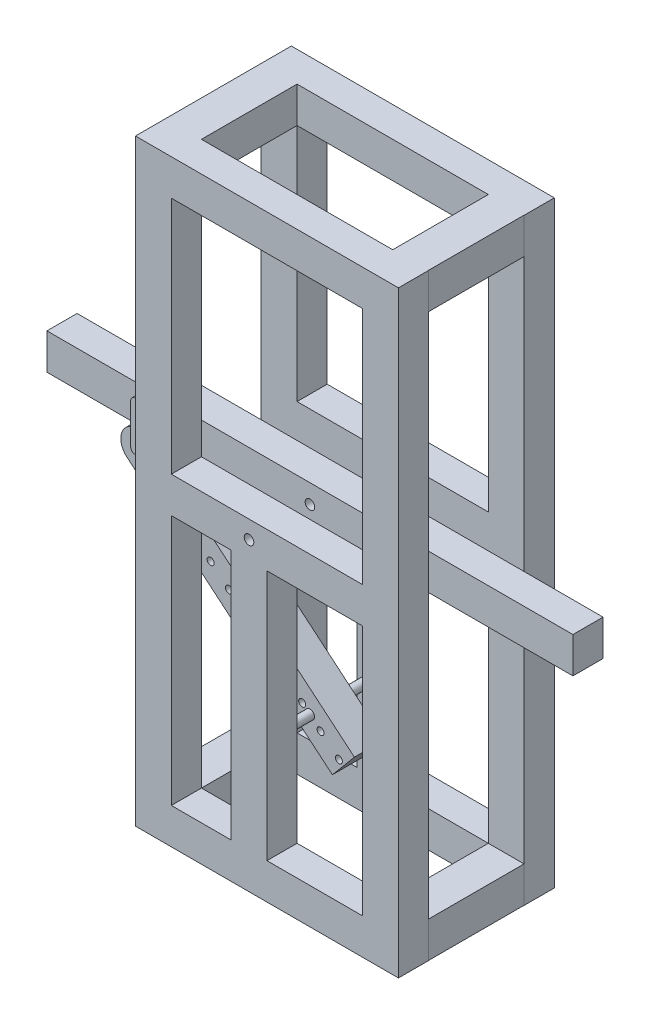
from build123d import *

# Parameters (mm, degrees)
ESQUISSE1_W                = 550
ESQUISSE1_H                = 1250
ESQUISSE1_W_2              = 125
ESQUISSE1_H_2              = 525
ESQUISSE1_W_3              = 200
ESQUISSE1_W_4              = 400
ESQUISSE1_H_3              = 500
BOSS_EXTRU_1_DEPTH         = 63
R_P_TITION_LIN_AIRE1_COUNT = 2
R_P_TITION_LIN_AIRE1_PITCH = 263
ESQUISSE2_W                = 75
ESQUISSE2_H                = 75
ESQUISSE2_W_2              = 74.718169062
BOSS_EXTRU_2_DEPTH         = 200
BOSS_EXTRU_4_DEPTH         = 550
BOSS_EXTRU_4_DEPTH_BACK    = 550
ESQUISSE7_W                = 63
ESQUISSE7_H                = 75
ESQUISSE3_R                = 10
ENL_V_MAT_EXTRU_2_DEPTH    = 1513.921759378
BOSS_EXTRU_5_DEPTH         = 63
BOSS_EXTRU_6_DEPTH         = 5
ESQUISSE12_R               = 7.355365699
ENL_V_MAT_EXTRU_3_DEPTH    = 100
R_P_TITION_LIN_AIRE2_COUNT = 12
R_P_TITION_LIN_AIRE2_PITCH = 50
BOSS_EXTRU_7_START         = -263
ESQUISSE13_R               = 9.503964929
BOSS_EXTRU_7_DEPTH         = 200


with BuildPart() as part:
    # Esquisse1 → Boss.-Extru.1 (new body)
    with BuildSketch(Plane.XY):
        with Locations((275, 625)):
            Rectangle(ESQUISSE1_W, ESQUISSE1_H)
        with Locations((137.5, 337.5)):
            Rectangle(ESQUISSE1_W_2, ESQUISSE1_H_2, mode=Mode.SUBTRACT)
        with Locations((375, 337.5)):
            Rectangle(ESQUISSE1_W_3, ESQUISSE1_H_2, mode=Mode.SUBTRACT)
        with Locations((275, 925)):
            Rectangle(ESQUISSE1_W_4, ESQUISSE1_H_3, mode=Mode.SUBTRACT)
    extrude(amount=BOSS_EXTRU_1_DEPTH)


with BuildPart() as r_p_tition_lin_aire1_1:
    # Répétition linéaire1: pattern copy
    add(part.part.moved(Location(Vector(0, 0, 1) * (1 * R_P_TITION_LIN_AIRE1_PITCH))))


with BuildPart() as part_1:
    add(part.part)

    add(r_p_tition_lin_aire1_1.part)  # Boss.-Extru.2 merges Répétition linéaire1_1
    # Esquisse2 → Boss.-Extru.2 (add)
    with BuildSketch(Plane.XY.offset(63)):
        with Locations((37.5, 37.5)):
            Rectangle(ESQUISSE2_W, ESQUISSE2_H)
        with Locations((512.359084531, 37.5)):
            Rectangle(ESQUISSE2_W_2, ESQUISSE2_H)
        with Locations((512.359084531, 1212.5)):
            Rectangle(ESQUISSE2_W_2, ESQUISSE2_H)
        with Locations((37.5, 1212.5)):
            Rectangle(ESQUISSE2_W, ESQUISSE2_H)
    extrude(amount=BOSS_EXTRU_2_DEPTH)


with BuildPart() as body_2:
    # Esquisse7 → Boss.-Extru.4 (new, two sides: drawn at the far end of the back side and taken through both)
    with BuildSketch(Plane.ZY.offset(-237.5).offset(-BOSS_EXTRU_4_DEPTH_BACK)):
        with Locations((167.0850662, 639.649163537)):
            Rectangle(ESQUISSE7_W, ESQUISSE7_H)
    extrude(amount=BOSS_EXTRU_4_DEPTH + BOSS_EXTRU_4_DEPTH_BACK)


with BuildPart() as enl_v_mat_extru_2_tool:
    # Esquisse3 → Enlèv. mat.-Extru.2 (new, through all)
    with BuildSketch(Plane.XY.offset(326)):
        with Locations((237.5, 637.5)):
            Circle(ESQUISSE3_R)
    extrude(amount=-ENL_V_MAT_EXTRU_2_DEPTH)


with BuildPart() as part_2:
    add(part_1.part)

    # Enlèv. mat.-Extru.2: cut by enl_v_mat_extru_2_tool
    add(enl_v_mat_extru_2_tool.part, mode=Mode.SUBTRACT)



with BuildPart() as body_2_1:
    add(body_2.part)

    # Enlèv. mat.-Extru.2: cut by enl_v_mat_extru_2_tool
    add(enl_v_mat_extru_2_tool.part, mode=Mode.SUBTRACT)



with BuildPart() as body_3:
    # Esquisse11 → Boss.-Extru.5 (new body)
    with BuildSketch(Plane.XY.offset(198.5850662)):
        with BuildLine():
            Line((-99.153084709, 586.914270743), (330.503621206, 226.557033524))
            Line((330.503621206, 226.557033524), (284.435304351, 171.629424966))
            Line((284.435304351, 171.629424966), (-145.221401564, 531.986662185))
            ThreePointArc((-145.221401564, 531.986662185), (-149.651047416, 582.484624891), (-99.153084709, 586.914270743))
        make_face()
    extrude(amount=-BOSS_EXTRU_5_DEPTH)


with BuildPart() as body_2_2:
    add(body_2_1.part)

    add(body_3.part)  # Boss.-Extru.6 merges body 3
    # Esquisse11<3> → Boss.-Extru.6 (add)
    with BuildSketch(Plane.XY.offset(198.5850662)):
        with BuildLine():
            Line((-114.54998443, 559.450466464), (-114.54998443, 643.613737641))
            ThreePointArc((-114.54998443, 643.613737641), (-123.445013511, 652.508766722), (-132.340042592, 643.613737641))
            Line((-132.340042592, 643.613737641), (-132.340042592, 559.450466464))
            ThreePointArc((-132.340042592, 559.450466464), (-123.445013511, 550.555437383), (-114.54998443, 559.450466464))
        make_face()
    extrude(amount=BOSS_EXTRU_6_DEPTH)

    # Esquisse12 → Enlèv. mat.-Extru.3 (cut)
    with BuildSketch(Plane.XY.offset(198.5850662)):
        with Locations((-123.445013511, 559.450466464)):
            Circle(ESQUISSE12_R)
    enl_v_mat_extru_3 = extrude(amount=-ENL_V_MAT_EXTRU_3_DEPTH, mode=Mode.SUBTRACT)

    # Répétition linéaire2: Enlèv. mat.-Extru.3 ×12
    with Locations(*[Vector(0.7661915431257939, -0.6426122619764696, 0) * (i * R_P_TITION_LIN_AIRE2_PITCH) for i in range(1, R_P_TITION_LIN_AIRE2_COUNT)]):
        add(enl_v_mat_extru_3, mode=Mode.SUBTRACT)


with BuildPart() as part_3:
    add(part_2.part)

    add(body_2_2.part)  # Boss.-Extru.7 merges body 2
    # Esquisse13 → Boss.-Extru.7 (add)
    with BuildSketch(Plane.XY.offset(326).offset(BOSS_EXTRU_7_START)):
        with Locations((237.5, 257.608372702)):
            Circle(ESQUISSE13_R)
    extrude(amount=BOSS_EXTRU_7_DEPTH)


solid = part_3.part
